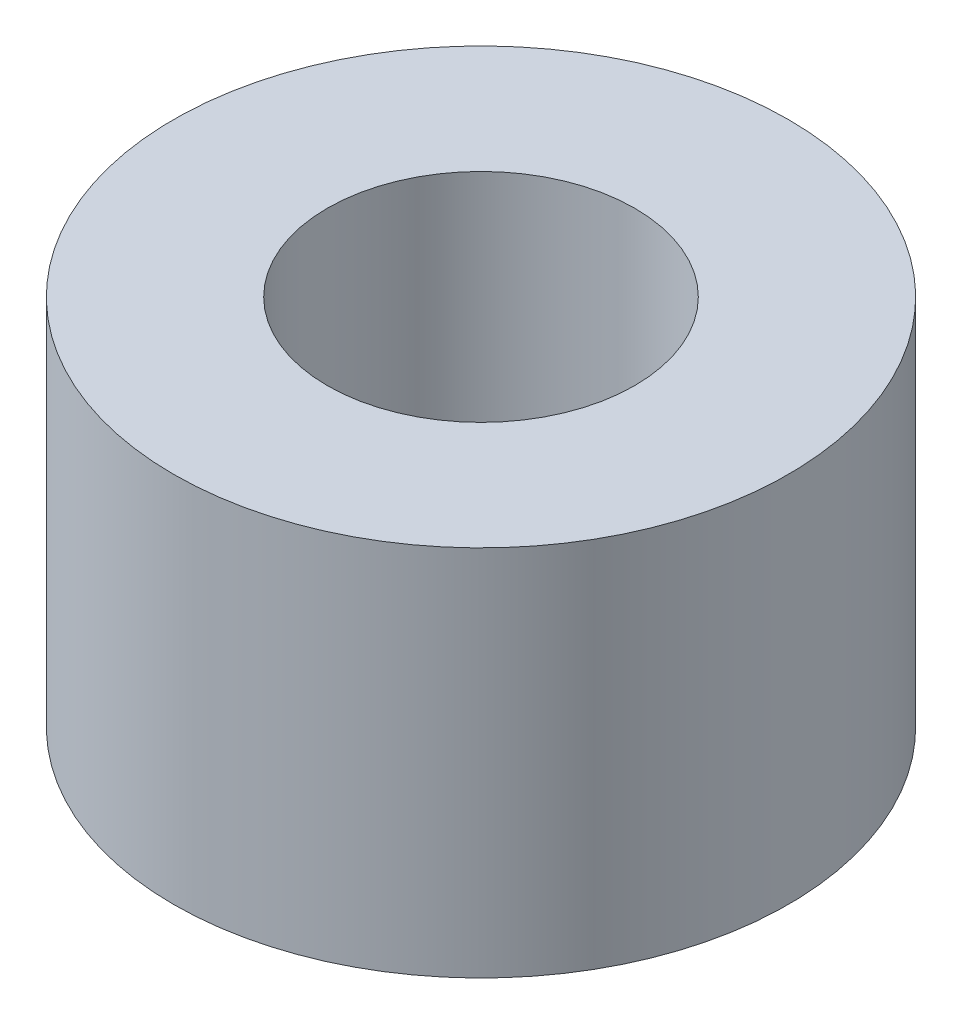
from build123d import *

# Parameters (mm, degrees)
SKETCH1_W                 = 2.5
SKETCH1_H                 = 3.03
M3X0_5_TAPPED_HOLE1_D     = 2.5
M3X0_5_TAPPED_HOLE1_DEPTH = 8.5
M3X0_5_TAPPED_HOLE1_TIP   = 0.751075774


with BuildPart() as part:
    # Sketch1 → Revolve1 (revolve)
    with BuildSketch(Plane.XY):
        with Locations((1.25, 1.515)):
            Rectangle(SKETCH1_W, SKETCH1_H)
    revolve(axis=Axis((0, 0, 0), (0, -1, 0)))

    # M3x0.5 Tapped Hole1
    with Locations(Plane(origin=(0, 3.03, 0), x_dir=(1, 0, 0), z_dir=(0, 1, 0))):
        with Locations((0, 0)):
            Hole(M3X0_5_TAPPED_HOLE1_D / 2, depth=M3X0_5_TAPPED_HOLE1_DEPTH)
            with Locations((0, 0, -(M3X0_5_TAPPED_HOLE1_DEPTH + M3X0_5_TAPPED_HOLE1_TIP / 2))):  # 118° drill point
                Cone(0, M3X0_5_TAPPED_HOLE1_D / 2, M3X0_5_TAPPED_HOLE1_TIP, mode=Mode.SUBTRACT)


solid = part.part
